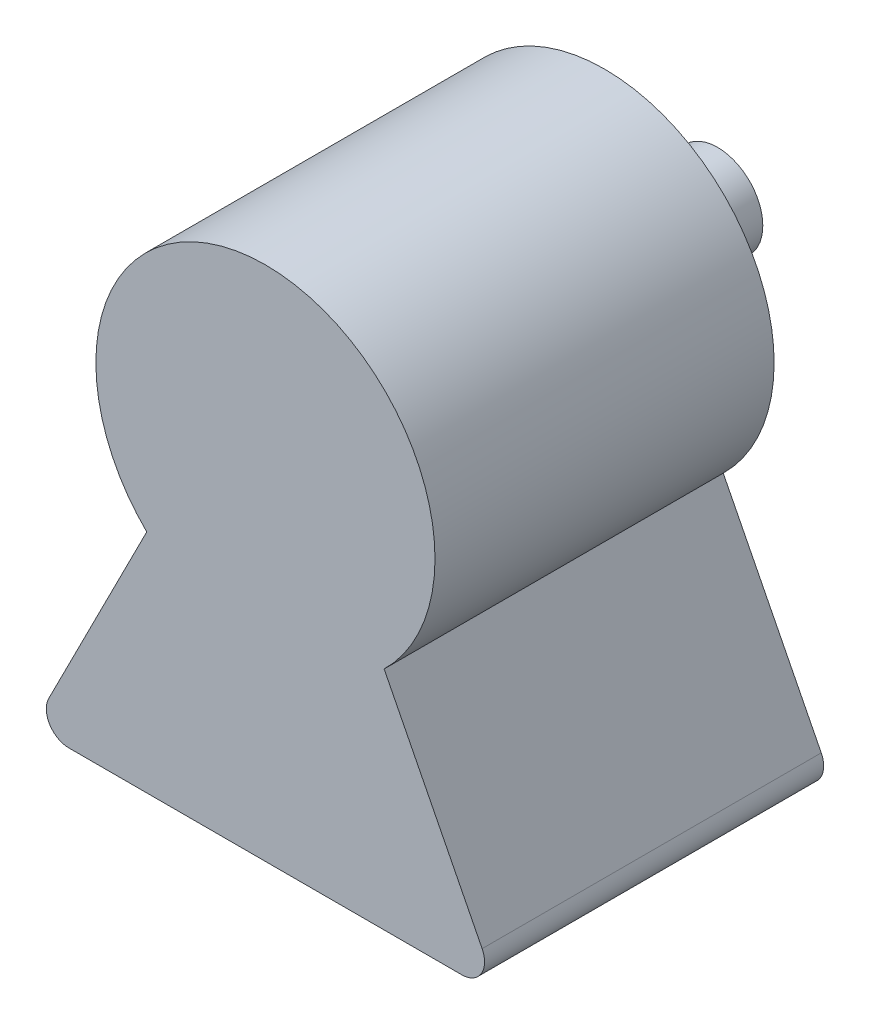
from build123d import *

# Parameters (mm, degrees)
SKETCH1_R           = 2
BOSS_EXTRUDE1_DEPTH = 5
SKETCH2_R           = 7.5
BOSS_EXTRUDE2_DEPTH = 15
BOSS_EXTRUDE3_DEPTH = 15
FILLET1_R           = 1


with BuildPart() as part:
    # Sketch1 → Boss-Extrude1 (new body)
    with BuildSketch(Plane.XY):
        Circle(SKETCH1_R)
    extrude(amount=BOSS_EXTRUDE1_DEPTH)

    # Sketch2 → Boss-Extrude2 (add)
    with BuildSketch(Plane.XY.offset(5)):
        Circle(SKETCH2_R)
    extrude(amount=BOSS_EXTRUDE2_DEPTH)

    # Sketch3 → Boss-Extrude3 (add)
    with BuildSketch(Plane.XY.offset(20)):
        Polygon((-5.249682076, -5.356382931), (-10.321706995, -15.355132011), (10.321706995, -15.355132011), (5.249682076, -5.356382931), align=None)
    extrude(amount=-BOSS_EXTRUDE3_DEPTH)

    # Fillet1
    fillet1_edges = [part.edges().sort_by_distance(p)[0] for p in [
        (10.321706995, -15.355132011, 12.5),
        (-10.321706995, -15.355132011, 12.5),
    ]]
    fillet(fillet1_edges, radius=FILLET1_R)


solid = part.part
